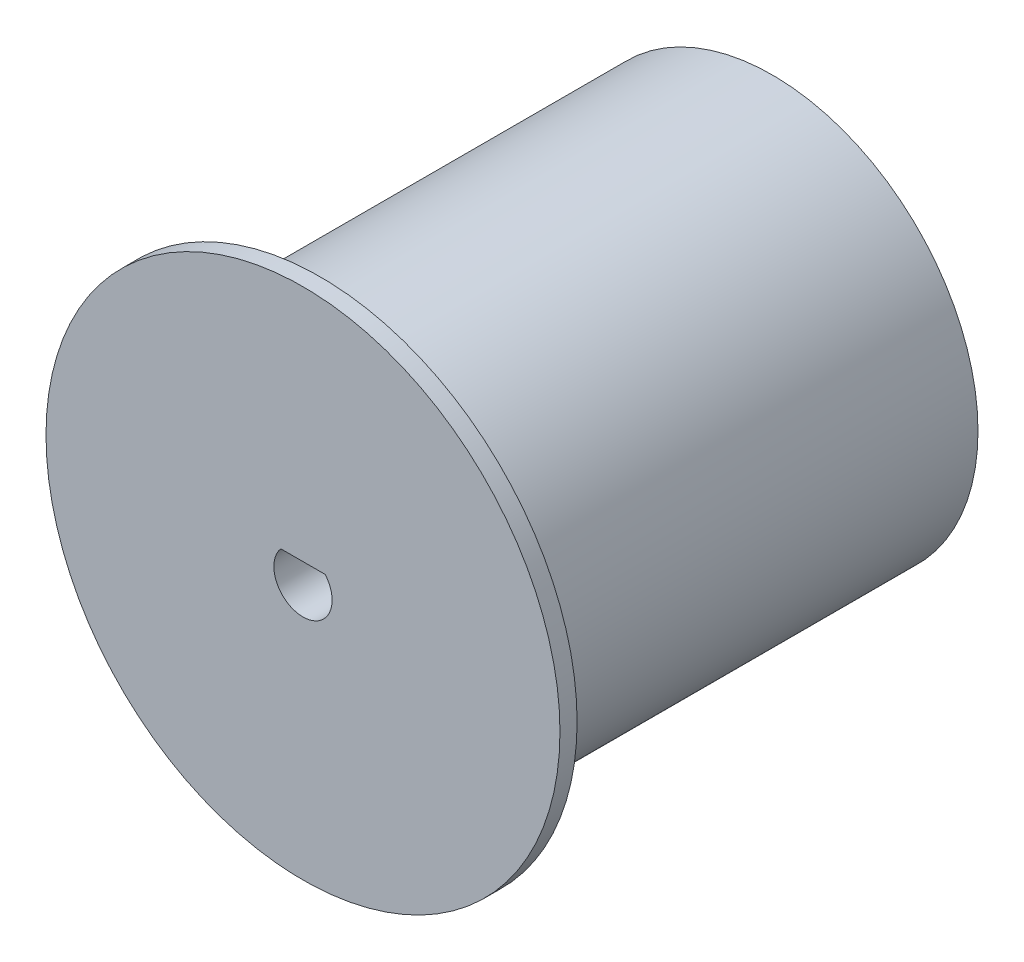
from build123d import *

# Parameters (mm, degrees)
CUT_EXTRUDE_1_DEPTH = 10


with BuildPart() as part:
    # Эскиз1 → Повернуть1 (revolve)
    with BuildSketch(Plane(origin=(0, 0, 0), x_dir=(1, 0, 0), z_dir=(0, 1, 0))):
        Polygon((0, 0), (15, 0), (15, 1), (12, 1), (12, 27.4), (9.25, 27.4), (9.25, 7.4), (0, 7.4), align=None)
    revolve(axis=Axis((0, 0, 0), (0, 0, -1)))

    # Эскиз2 → Вырез-Вытянуть1 (cut)
    # profile 1 of 2: a face of its own
    with BuildSketch(Plane.XY):
        with BuildLine():
            Line((-1.29614814, 1.1), (1.29614814, 1.1))
            ThreePointArc((1.29614814, 1.1), (0, -1.7), (-1.29614814, 1.1))
        make_face()
        with BuildLine():
            ThreePointArc((-1.2, 0.9), (0, -1.5), (1.2, 0.9))
            Line((1.2, 0.9), (-1.2, 0.9))
        make_face(mode=Mode.SUBTRACT)
    # profile 2 of 2: a face of its own
    with BuildSketch(Plane.XY):
        with BuildLine():
            Line((-1.2, 0.9), (1.2, 0.9))
            ThreePointArc((1.2, 0.9), (0, -1.5), (-1.2, 0.9))
        make_face()
    extrude(amount=-CUT_EXTRUDE_1_DEPTH, mode=Mode.SUBTRACT)


solid = part.part
